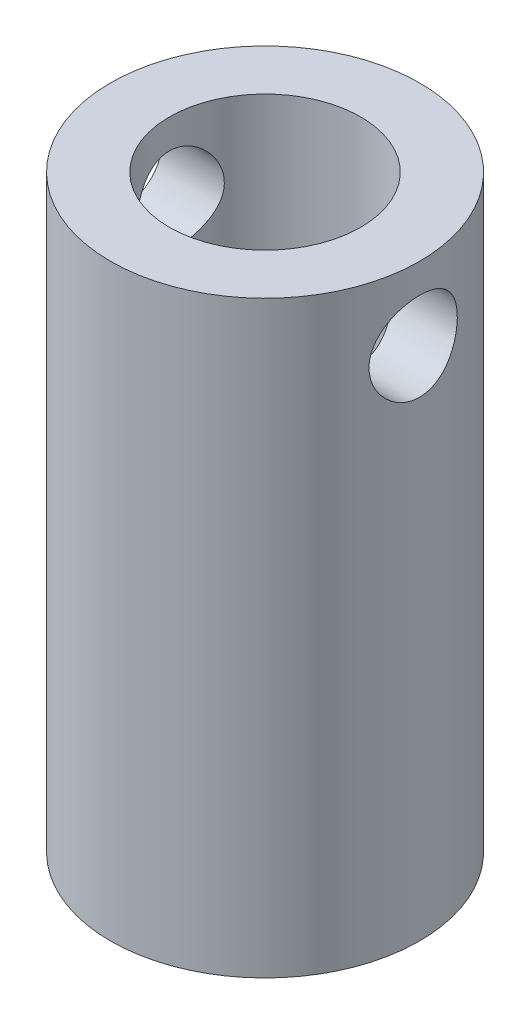
from build123d import *

# Parameters (mm, degrees)
SKETCH1_R               = 5.25
SKETCH1_R_2             = 3.25
BOSS_EXTRUDE1_DEPTH     = 20
CUT_EXTRUDE1_DEPTH      = 20
CUT_EXTRUDE1_DEPTH_BACK = 20
SKETCH2_R               = 1.5


with BuildPart() as part:
    # Sketch1 → Boss-Extrude1 (new body)
    with BuildSketch(Plane(origin=(0, 0, 0), x_dir=(1, 0, 0), z_dir=(0, 1, 0))):
        Circle(SKETCH1_R)
        Circle(SKETCH1_R_2, mode=Mode.SUBTRACT)
    extrude(amount=BOSS_EXTRUDE1_DEPTH)

    # Sketch2 → Cut-Extrude1 (cut, two sides: drawn at the far end of the back side and taken through both)
    with BuildSketch(Plane(origin=(0, 0, 0), x_dir=(0, 0, -1), z_dir=(1, 0, 0)).offset(-CUT_EXTRUDE1_DEPTH_BACK)):
        with Locations((0, 17.5)):
            Circle(SKETCH2_R)
    extrude(amount=CUT_EXTRUDE1_DEPTH + CUT_EXTRUDE1_DEPTH_BACK, mode=Mode.SUBTRACT)


solid = part.part
